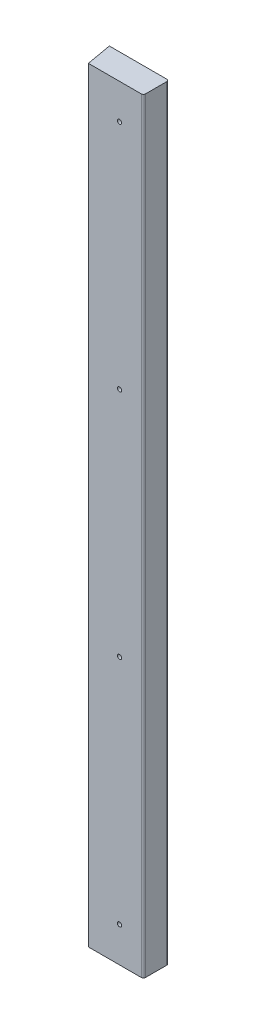
from build123d import *

# Parameters (mm, degrees)
BOSS_EXTRUDE1_DEPTH         = 1143
F_1_4_0_25_DIAMETER_HOLE1_D = 6.35
FILLET2_R                   = 3.175


with BuildPart() as part:
    # Sketch1 → Boss-Extrude1 (new body)
    with BuildSketch(Plane(origin=(0, 0, 0), x_dir=(1, 0, 0), z_dir=(0, 1, 0))):
        Polygon((-44.45, 19.05), (-37.731942035, -19.05), (44.45, -19.05), (44.45, 19.05), align=None)
    extrude(amount=BOSS_EXTRUDE1_DEPTH)

    # 1/4 (0.25) Diameter Hole1 (through all)
    with Locations(Plane(origin=(0, 0, 19.05), x_dir=(-1, 0, 0), z_dir=(0, 0, 1))):
        with Locations((-8.817444165, -52.3875), (-8.817444165, -398.4625), (-8.817444165, -744.5375), (-8.817444165, -1090.6125)):
            Hole(F_1_4_0_25_DIAMETER_HOLE1_D / 2)

    # Fillet2
    fillet2_edges = [part.edges().sort_by_distance(p)[0] for p in [
        (44.45, 571.5, -19.05),
        (44.45, 571.5, 19.05),
    ]]
    fillet(fillet2_edges, radius=FILLET2_R)


solid = part.part
